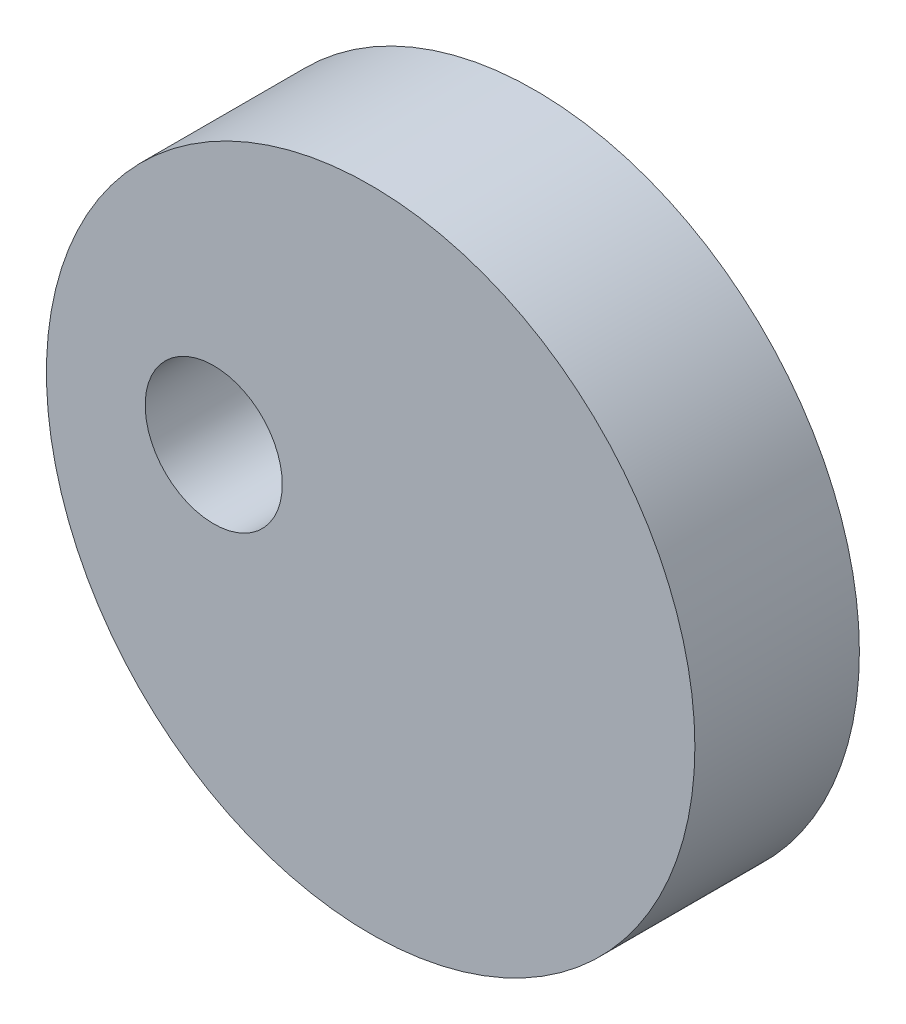
from build123d import *

# Parameters (mm, degrees)
SKETCH1_R              = 59.129838757
BOSS_EXTRUDE1_DEPTH    = 30
F_25_0MM_DOWEL_HOLE1_D = 25


with BuildPart() as part:
    # Sketch1 → Boss-Extrude1 (new body)
    with BuildSketch(Plane.XY):
        Circle(SKETCH1_R)
    extrude(amount=BOSS_EXTRUDE1_DEPTH)

    # Ø25.0mm Dowel Hole1 (through all)
    with Locations(Plane.XY.offset(30)):
        with Locations((-28.621457158, 3.819995278)):
            Hole(F_25_0MM_DOWEL_HOLE1_D / 2)


solid = part.part
